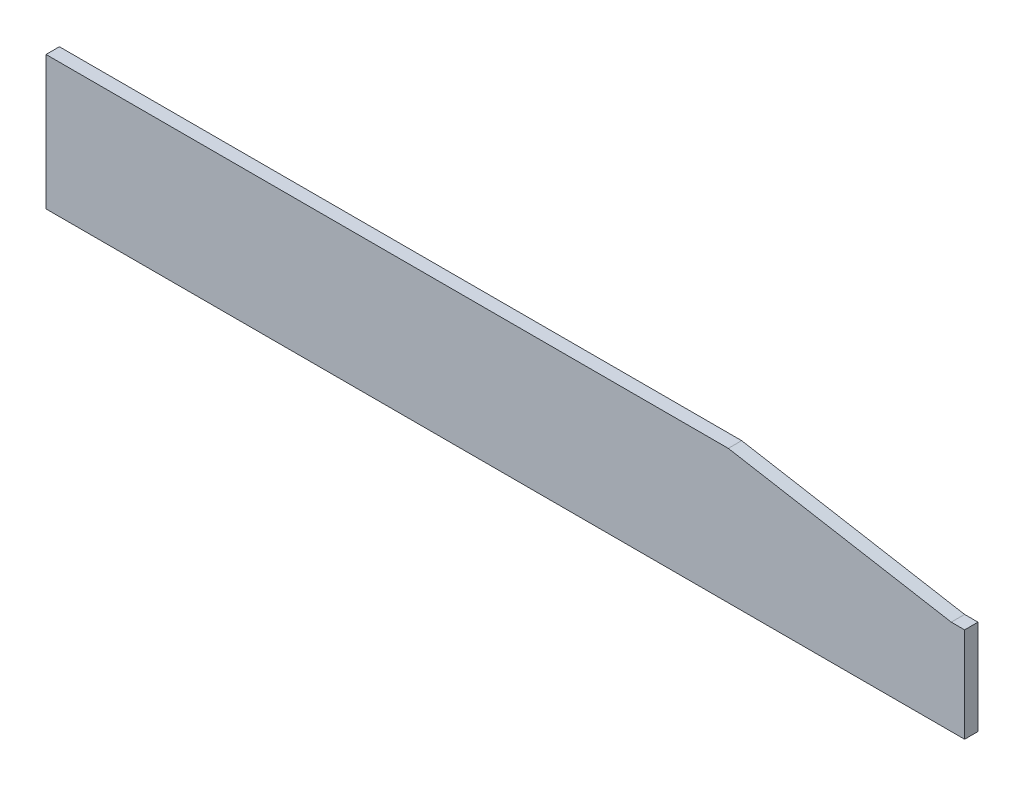
from build123d import *

# Parameters (mm, degrees)
BOSS_EXTRUDE1_DEPTH = 6


with BuildPart() as part:
    # Sketch1 → Boss-Extrude1 (new body)
    with BuildSketch(Plane.XY):
        Polygon((-83.65523725, 53.378094506), (-83.65523725, -6.621905494), (328.34476275, -6.621905494), (328.34476275, 35.878094506), (322.34476275, 35.878094506), (222.34476275, 53.378094506), align=None)
    extrude(amount=BOSS_EXTRUDE1_DEPTH)


solid = part.part
